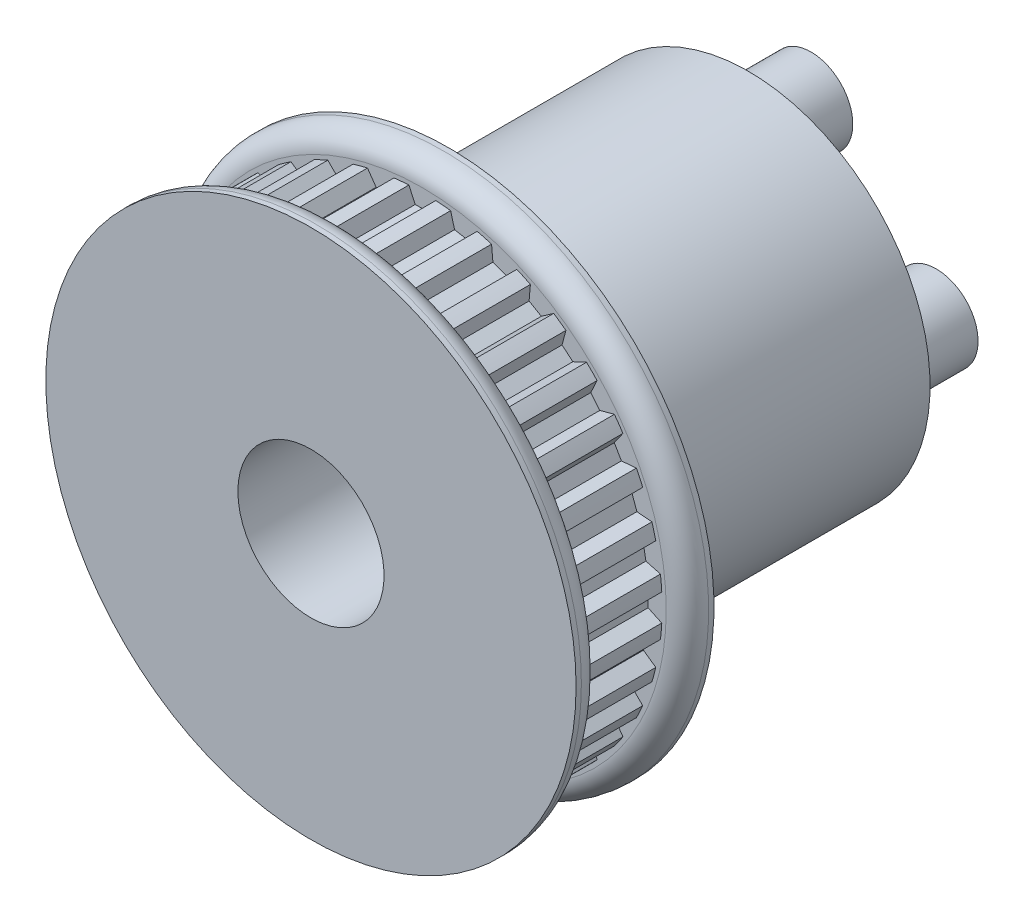
from build123d import *
from build123d.topology import SkipClean

# Parameters (mm, degrees)
MODEL_R             = 3.175
BOSS_EXTRUDE1_DEPTH = 4.064
BOSS_EXTRUDE2_START = 1.27
SKETCH2_R           = 12.7
SKETCH2_R_2         = 3.175
BOSS_EXTRUDE2_DEPTH = 1.27
SKETCH3_R           = 12.7
SKETCH3_R_2         = 3.175
BOSS_EXTRUDE3_DEPTH = 1.27
FILLET1_R           = 1.016
SKETCH5_R           = 8.7
BOSS_EXTRUDE4_DEPTH = 14.35
SKETCH6_R           = 2
BOSS_EXTRUDE5_DEPTH = 3
SKETCH7_R           = 1.75
CUT_EXTRUDE1_DEPTH  = 3
SKETCH8_R           = 3.5
CUT_EXTRUDE2_DEPTH  = 26.395395618


with BuildPart() as part:
    # Model → Boss-Extrude1 (new body)
    with BuildSketch(Plane.XY):
        with BuildLine():
            Line((10.591943248, 2.211740118), (10.709630583, 1.544302073))
            Line((10.709630583, 1.544302073), (11.406652082, 1.357535725))
            ThreePointArc((11.406652082, 1.357535725), (11.44343792, 1.001171089), (11.469093011, 0.643832639))
            Line((11.469093011, 0.643832639), (10.815092471, 0.338867178))
            Line((10.815092471, 0.338867178), (10.815092471, -0.338867174))
            Line((10.815092471, -0.338867174), (11.469093011, -0.643832634))
            ThreePointArc((11.469093011, -0.643832634), (11.443437919, -1.001171089), (11.406652081, -1.357535729))
            Line((11.406652081, -1.357535729), (10.709630582, -1.544302077))
            Line((10.709630582, -1.544302077), (10.591943246, -2.211740121))
            Line((10.591943246, -2.211740121), (11.183051353, -2.625638473))
            ThreePointArc((11.183051353, -2.625638473), (11.095734848, -2.973093192), (10.9976258, -3.317656057))
            Line((10.9976258, -3.317656057), (10.278761988, -3.380548491))
            Line((10.278761988, -3.380548491), (10.046963187, -4.017410461))
            Line((10.046963187, -4.017410461), (10.557218339, -4.527665612))
            ThreePointArc((10.557218339, -4.527665612), (10.410893489, -4.854679361), (10.254442225, -5.176971085))
            Line((10.254442225, -5.176971085), (9.535578412, -5.11407865))
            Line((9.535578412, -5.11407865), (9.196711236, -5.701013816))
            Line((9.196711236, -5.701013816), (9.610609588, -6.292121923))
            ThreePointArc((9.610609588, -6.292121923), (9.4097224, -6.588758554), (9.199682611, -6.878986465))
            Line((9.199682611, -6.878986465), (8.502661112, -6.692220117))
            Line((8.502661112, -6.692220117), (8.067021868, -7.211394752))
            Line((8.067021868, -7.211394752), (8.371987328, -7.865395293))
            ThreePointArc((8.371987328, -7.865395293), (8.122641656, -8.122641655), (7.865395293, -8.371987328))
            Line((7.865395293, -8.371987328), (7.211394752, -8.067021867))
            Line((7.211394752, -8.067021867), (6.692220118, -8.502661111))
            Line((6.692220118, -8.502661111), (6.878986466, -9.19968261))
            ThreePointArc((6.878986466, -9.19968261), (6.588758556, -9.409722399), (6.292121925, -9.610609585))
            Line((6.292121925, -9.610609585), (5.701013819, -9.196711233))
            Line((5.701013819, -9.196711233), (5.114078653, -9.53557841))
            Line((5.114078653, -9.53557841), (5.176971087, -10.254442222))
            ThreePointArc((5.176971087, -10.254442222), (4.854679362, -10.410893488), (4.527665612, -10.557218338))
            Line((4.527665612, -10.557218338), (4.017410461, -10.046963186))
            Line((4.017410461, -10.046963186), (3.380548491, -10.278761986))
            Line((3.380548491, -10.278761986), (3.317656057, -10.997625799))
            ThreePointArc((3.317656057, -10.997625799), (2.97309319, -11.095734848), (2.625638469, -11.183051352))
            Line((2.625638469, -11.183051352), (2.211740117, -10.591943246))
            Line((2.211740117, -10.591943246), (1.544302073, -10.709630581))
            Line((1.544302073, -10.709630581), (1.357535725, -11.40665208))
            ThreePointArc((1.357535725, -11.40665208), (1.001171088, -11.443437918), (0.643832637, -11.469093009))
            Line((0.643832637, -11.469093009), (0.338867176, -10.815092469))
            Line((0.338867176, -10.815092469), (-0.338867176, -10.815092469))
            Line((-0.338867176, -10.815092469), (-0.643832637, -11.469093009))
            ThreePointArc((-0.643832637, -11.469093009), (-1.00117109, -11.443437918), (-1.357535729, -11.40665208))
            Line((-1.357535729, -11.40665208), (-1.544302077, -10.70963058))
            Line((-1.544302077, -10.70963058), (-2.211740121, -10.591943245))
            Line((-2.211740121, -10.591943245), (-2.625638473, -11.183051352))
            ThreePointArc((-2.625638473, -11.183051352), (-2.973093192, -11.095734847), (-3.317656057, -10.997625799))
            Line((-3.317656057, -10.997625799), (-3.380548492, -10.278761986))
            Line((-3.380548492, -10.278761986), (-4.017410461, -10.046963186))
            Line((-4.017410461, -10.046963186), (-4.527665613, -10.557218338))
            ThreePointArc((-4.527665613, -10.557218338), (-4.854679361, -10.410893489), (-5.176971084, -10.254442224))
            Line((-5.176971084, -10.254442224), (-5.11407865, -9.535578411))
            Line((-5.11407865, -9.535578411), (-5.701013816, -9.196711235))
            Line((-5.701013816, -9.196711235), (-6.292121923, -9.610609588))
            ThreePointArc((-6.292121923, -9.610609588), (-6.588758555, -9.4097224), (-6.878986466, -9.19968261))
            Line((-6.878986466, -9.19968261), (-6.692220119, -8.502661111))
            Line((-6.692220119, -8.502661111), (-7.211394753, -8.067021867))
            Line((-7.211394753, -8.067021867), (-7.865395294, -8.371987328))
            ThreePointArc((-7.865395294, -8.371987328), (-8.122641656, -8.122641656), (-8.371987327, -7.865395294))
            Line((-8.371987327, -7.865395294), (-8.067021867, -7.211394754))
            Line((-8.067021867, -7.211394754), (-8.502661111, -6.692220119))
            Line((-8.502661111, -6.692220119), (-9.19968261, -6.878986467))
            ThreePointArc((-9.19968261, -6.878986467), (-9.4097224, -6.588758555), (-9.610609588, -6.292121923))
            Line((-9.610609588, -6.292121923), (-9.196711236, -5.701013817))
            Line((-9.196711236, -5.701013817), (-9.535578412, -5.114078651))
            Line((-9.535578412, -5.114078651), (-10.254442225, -5.176971085))
            ThreePointArc((-10.254442225, -5.176971085), (-10.410893489, -4.854679362), (-10.557218339, -4.527665613))
            Line((-10.557218339, -4.527665613), (-10.046963187, -4.017410462))
            Line((-10.046963187, -4.017410462), (-10.278761988, -3.380548492))
            Line((-10.278761988, -3.380548492), (-10.9976258, -3.317656058))
            ThreePointArc((-10.9976258, -3.317656058), (-11.095734849, -2.973093192), (-11.183051354, -2.625638473))
            Line((-11.183051354, -2.625638473), (-10.591943247, -2.211740121))
            Line((-10.591943247, -2.211740121), (-10.709630582, -1.544302076))
            Line((-10.709630582, -1.544302076), (-11.406652082, -1.357535728))
            ThreePointArc((-11.406652082, -1.357535728), (-11.44343792, -1.001171088), (-11.469093012, -0.643832634))
            Line((-11.469093012, -0.643832634), (-10.815092471, -0.338867174))
            Line((-10.815092471, -0.338867174), (-10.815092471, 0.338867178))
            Line((-10.815092471, 0.338867178), (-11.469093012, 0.643832639))
            ThreePointArc((-11.469093012, 0.643832639), (-11.44343792, 1.001171091), (-11.406652082, 1.357535729))
            Line((-11.406652082, 1.357535729), (-10.709630583, 1.544302076))
            Line((-10.709630583, 1.544302076), (-10.591943248, 2.211740121))
            Line((-10.591943248, 2.211740121), (-11.183051354, 2.625638473))
            ThreePointArc((-11.183051354, 2.625638473), (-11.09573485, 2.973093192), (-10.997625802, 3.317656058))
            Line((-10.997625802, 3.317656058), (-10.278761989, 3.380548492))
            Line((-10.278761989, 3.380548492), (-10.046963189, 4.017410462))
            Line((-10.046963189, 4.017410462), (-10.55721834, 4.527665615))
            ThreePointArc((-10.55721834, 4.527665615), (-10.410893491, 4.854679363), (-10.254442226, 5.176971086))
            Line((-10.254442226, 5.176971086), (-9.535578414, 5.114078651))
            Line((-9.535578414, 5.114078651), (-9.196711238, 5.701013817))
            Line((-9.196711238, 5.701013817), (-9.61060959, 6.292121924))
            ThreePointArc((-9.61060959, 6.292121924), (-9.409722403, 6.588758556), (-9.199682613, 6.878986467))
            Line((-9.199682613, 6.878986467), (-8.502661114, 6.692220119))
            Line((-8.502661114, 6.692220119), (-8.06702187, 7.211394754))
            Line((-8.06702187, 7.211394754), (-8.371987331, 7.865395295))
            ThreePointArc((-8.371987331, 7.865395295), (-8.122641658, 8.122641658), (-7.865395295, 8.37198733))
            Line((-7.865395295, 8.37198733), (-7.211394754, 8.06702187))
            Line((-7.211394754, 8.06702187), (-6.69222012, 8.502661114))
            Line((-6.69222012, 8.502661114), (-6.878986468, 9.199682613))
            ThreePointArc((-6.878986468, 9.199682613), (-6.588758558, 9.409722402), (-6.292121927, 9.610609589))
            Line((-6.292121927, 9.610609589), (-5.701013821, 9.196711237))
            Line((-5.701013821, 9.196711237), (-5.114078655, 9.535578413))
            Line((-5.114078655, 9.535578413), (-5.176971089, 10.254442226))
            ThreePointArc((-5.176971089, 10.254442226), (-4.854679364, 10.410893491), (-4.527665613, 10.557218342))
            Line((-4.527665613, 10.557218342), (-4.017410463, 10.04696319))
            Line((-4.017410463, 10.04696319), (-3.380548492, 10.27876199))
            Line((-3.380548492, 10.27876199), (-3.317656058, 10.997625803))
            ThreePointArc((-3.317656058, 10.997625803), (-2.973093191, 11.095734852), (-2.625638471, 11.183051356))
            Line((-2.625638471, 11.183051356), (-2.211740119, 10.59194325))
            Line((-2.211740119, 10.59194325), (-1.544302074, 10.709630585))
            Line((-1.544302074, 10.709630585), (-1.357535726, 11.406652084))
            ThreePointArc((-1.357535726, 11.406652084), (-1.001171089, 11.443437922), (-0.643832637, 11.469093014))
            Line((-0.643832637, 11.469093014), (-0.338867177, 10.815092473))
            Line((-0.338867177, 10.815092473), (0.338867176, 10.815092473))
            Line((0.338867176, 10.815092473), (0.643832636, 11.469093014))
            ThreePointArc((0.643832636, 11.469093014), (1.001171088, 11.443437922), (1.357535726, 11.406652084))
            Line((1.357535726, 11.406652084), (1.544302074, 10.709630585))
            Line((1.544302074, 10.709630585), (2.211740118, 10.59194325))
            Line((2.211740118, 10.59194325), (2.62563847, 11.183051356))
            ThreePointArc((2.62563847, 11.183051356), (2.973093191, 11.095734851), (3.317656059, 10.997625802))
            Line((3.317656059, 10.997625802), (3.380548493, 10.27876199))
            Line((3.380548493, 10.27876199), (4.017410463, 10.046963189))
            Line((4.017410463, 10.046963189), (4.527665615, 10.557218341))
            ThreePointArc((4.527665615, 10.557218341), (4.854679365, 10.410893491), (5.176971089, 10.254442225))
            Line((5.176971089, 10.254442225), (5.114078655, 9.535578413))
            Line((5.114078655, 9.535578413), (5.701013821, 9.196711237))
            Line((5.701013821, 9.196711237), (6.292121927, 9.610609588))
            ThreePointArc((6.292121927, 9.610609588), (6.588758557, 9.409722402), (6.878986467, 9.199682614))
            Line((6.878986467, 9.199682614), (6.692220119, 8.502661114))
            Line((6.692220119, 8.502661114), (7.211394754, 8.06702187))
            Line((7.211394754, 8.06702187), (7.865395294, 8.371987331))
            ThreePointArc((7.865395294, 8.371987331), (8.122641658, 8.122641658), (8.371987331, 7.865395294))
            Line((8.371987331, 7.865395294), (8.06702187, 7.211394754))
            Line((8.06702187, 7.211394754), (8.502661114, 6.692220119))
            Line((8.502661114, 6.692220119), (9.199682613, 6.878986467))
            ThreePointArc((9.199682613, 6.878986467), (9.409722401, 6.588758557), (9.610609588, 6.292121927))
            Line((9.610609588, 6.292121927), (9.196711236, 5.70101382))
            Line((9.196711236, 5.70101382), (9.535578412, 5.114078654))
            Line((9.535578412, 5.114078654), (10.254442225, 5.176971089))
            ThreePointArc((10.254442225, 5.176971089), (10.41089349, 4.854679364), (10.55721834, 4.527665614))
            Line((10.55721834, 4.527665614), (10.046963188, 4.017410463))
            Line((10.046963188, 4.017410463), (10.278761988, 3.380548493))
            Line((10.278761988, 3.380548493), (10.997625801, 3.317656059))
            ThreePointArc((10.997625801, 3.317656059), (11.09573485, 2.973093191), (11.183051355, 2.62563847))
            Line((11.183051355, 2.62563847), (10.591943248, 2.211740118))
        make_face()
        with Locations((0, 2e-09)):
            Circle(MODEL_R, mode=Mode.SUBTRACT)
    extrude(amount=BOSS_EXTRUDE1_DEPTH)

    # Sketch2 → Boss-Extrude2 (add)
    with SkipClean():  # the faces are left unmerged after this step: merging them gives an invalid solid
        with BuildSketch(Plane(origin=(0, 0, 0), x_dir=(-1, 0, 0), z_dir=(0, 0, -1)).offset(BOSS_EXTRUDE2_START)):
            Circle(SKETCH2_R)
            Circle(SKETCH2_R_2, mode=Mode.SUBTRACT)
        extrude(amount=-BOSS_EXTRUDE2_DEPTH)

    # Sketch3 → Boss-Extrude3 (add)
    with BuildSketch(Plane.XY.offset(4.064)):
        with Locations(Location((0, 2e-09, 0), (0, 0, 180.000000009))):
            Circle(SKETCH3_R)
        with Locations(Location((0, 2e-09, 0), (0, 0, 180))):
            Circle(SKETCH3_R_2, mode=Mode.SUBTRACT)
    extrude(amount=BOSS_EXTRUDE3_DEPTH)

    # Fillet1
    fillet1_edges = [part.edges().sort_by_distance(p)[0] for p in [
        (12.7, 0, 0),
        (12.7, 4e-09, 4.064),
    ]]
    fillet(fillet1_edges, radius=FILLET1_R)

    # Sketch5 → Boss-Extrude4 (add)
    with BuildSketch(Plane(origin=(0, 0, -1.27), x_dir=(-1, 0, 0), z_dir=(0, 0, -1))):
        Circle(SKETCH5_R)
    extrude(amount=BOSS_EXTRUDE4_DEPTH)

    # Sketch6 → Boss-Extrude5 (add)
    with BuildSketch(Plane(origin=(0, 0, -15.62), x_dir=(-1, 0, 0), z_dir=(0, 0, -1))):
        with Locations((0, 6)):
            Circle(SKETCH6_R)
        with Locations((-6, 0)):
            Circle(SKETCH6_R)
        with Locations((0, -6)):
            Circle(SKETCH6_R)
        with Locations((6, 0)):
            Circle(SKETCH6_R)
    extrude(amount=BOSS_EXTRUDE5_DEPTH)

    # Sketch7 → Cut-Extrude1 (cut)
    with BuildSketch(Plane(origin=(0, 0, -15.62), x_dir=(-1, 0, 0), z_dir=(0, 0, -1))):
        Circle(SKETCH7_R)
    extrude(amount=-CUT_EXTRUDE1_DEPTH, mode=Mode.SUBTRACT)

    # Sketch8 → Cut-Extrude2 (cut, through all)
    with BuildSketch(Plane(origin=(0, 0, -12.62), x_dir=(-1, 0, 0), z_dir=(0, 0, -1))):
        Circle(SKETCH8_R)
    extrude(amount=-CUT_EXTRUDE2_DEPTH, mode=Mode.SUBTRACT)


solid = part.part
